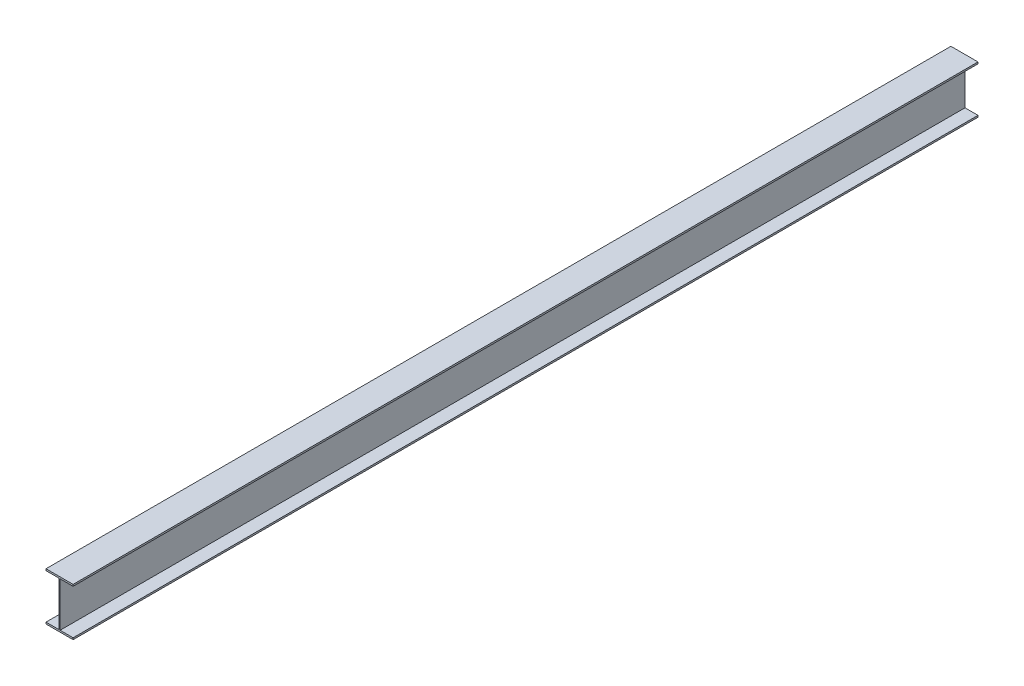
from build123d import *

# Parameters (mm, degrees)
BOSS_EXTRUDE1_DEPTH = 4876.8


with BuildPart() as part:
    # Sketch2 → Boss-Extrude1 (new body)
    with BuildSketch(Plane.XY):
        Polygon((-73.025, 129.159), (-73.025, 120.015), (-3.048, 120.015), (-3.048, -120.015), (-73.025, -120.015), (-73.025, -129.159), (73.025, -129.159), (73.025, -120.015), (3.048, -120.015), (3.048, 120.015), (73.025, 120.015), (73.025, 129.159), align=None)
    extrude(amount=BOSS_EXTRUDE1_DEPTH)


solid = part.part
